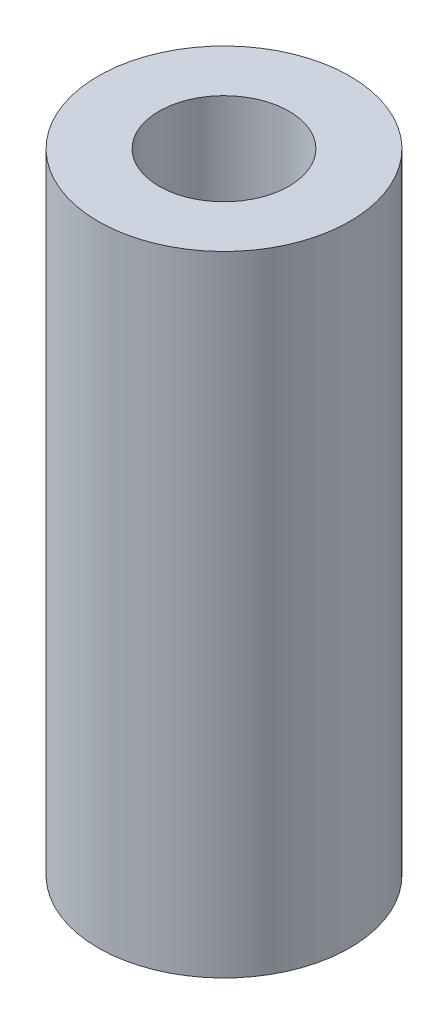
from build123d import *

# Parameters (mm, degrees)
SKETCH_1_R      = 3
SKETCH_1_R_2    = 1.55
EXTRUDE_1_DEPTH = 15


with BuildPart() as part:
    # 草图1 → 凸台-拉伸1 (new body)
    with BuildSketch(Plane(origin=(0, 0, 0), x_dir=(1, 0, 0), z_dir=(0, 1, 0))):
        with Locations(Location((0, 0, 0), (0, 0, 270))):
            Circle(SKETCH_1_R)
        with Locations(Location((0, 0, 0), (0, 0, 270))):
            Circle(SKETCH_1_R_2, mode=Mode.SUBTRACT)
    extrude(amount=EXTRUDE_1_DEPTH)


solid = part.part
